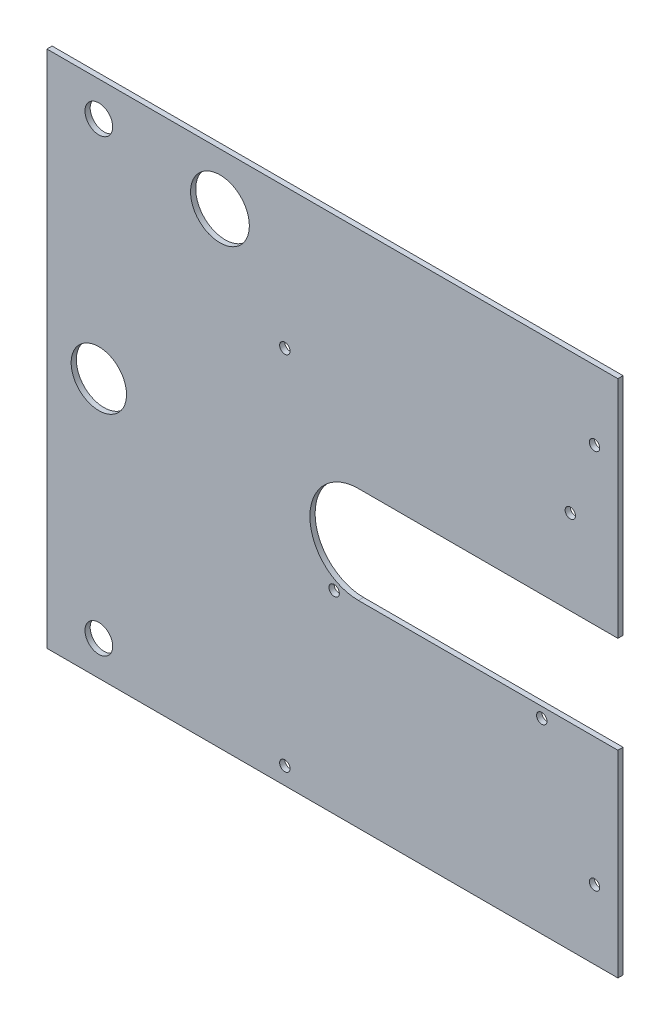
from build123d import *

# Parameters (mm, degrees)
ESQUISSE1_W             = 165
ESQUISSE1_H             = 150
BOSS_EXTRU_1_DEPTH      = 1.5
ESQUISSE2_R             = 1.5
ESQUISSE2_R_2           = 8
ESQUISSE2_R_3           = 4
ESQUISSE2_R_4           = 8.5
ENL_V_MAT_EXTRU_1_DEPTH = 182.251896542


with BuildPart() as part:
    # Esquisse1 → Boss.-Extru.1 (new body)
    with BuildSketch(Plane.XY):
        with Locations((82.5, 0)):
            Rectangle(ESQUISSE1_W, ESQUISSE1_H)
    extrude(amount=BOSS_EXTRU_1_DEPTH)

    # Esquisse2 → Enlèv. mat.-Extru.1 (cut, through all)
    with BuildSketch(Plane.XY.offset(1.5)):
        with Locations((158.25, 55)):
            Circle(ESQUISSE2_R)
        with Locations((158.25, -55)):
            Circle(ESQUISSE2_R)
        with Locations((151.25, 34.5)):
            Circle(ESQUISSE2_R)
        with Locations((83, -19)):
            Circle(ESQUISSE2_R)
        with Locations((143, -21)):
            Circle(ESQUISSE2_R)
        with Locations((15, 0)):
            Circle(ESQUISSE2_R_2)
        with Locations((15, 65)):
            Circle(ESQUISSE2_R_3)
        with Locations((15, -65)):
            Circle(ESQUISSE2_R_3)
        with Locations((50, 60)):
            Circle(ESQUISSE2_R_4)
        with Locations((68.75, 34.5)):
            Circle(ESQUISSE2_R)
        with Locations((68.75, -70)):
            Circle(ESQUISSE2_R)
        with BuildLine():
            Line((90, 10), (165, 10))
            ThreePointArc((165, 10), (179, -4), (165, -18))
            Line((165, -18), (90, -18))
            ThreePointArc((90, -18), (76, -4), (90, 10))
        make_face()
    extrude(amount=-ENL_V_MAT_EXTRU_1_DEPTH, mode=Mode.SUBTRACT)


solid = part.part
